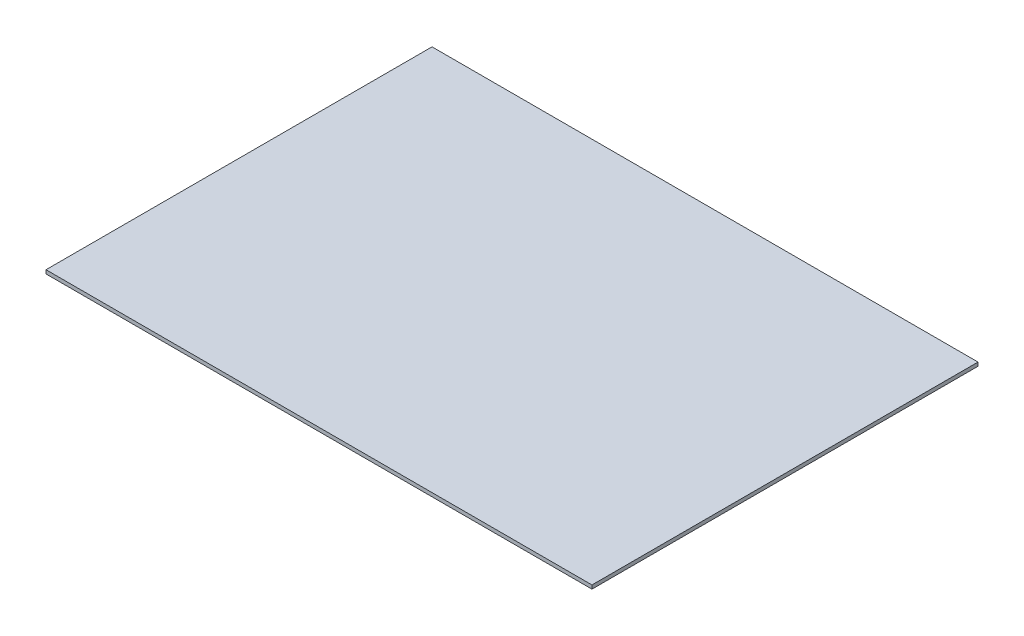
from build123d import *

# Parameters (mm, degrees)
SKETCH1_W           = 297
SKETCH1_H           = 210
BOSS_EXTRUDE1_DEPTH = 2


with BuildPart() as part:
    # Sketch1 → Boss-Extrude1 (new body)
    with BuildSketch(Plane(origin=(0, 0, 0), x_dir=(1, 0, 0), z_dir=(0, 1, 0))):
        Rectangle(SKETCH1_W, SKETCH1_H)
    extrude(amount=BOSS_EXTRUDE1_DEPTH)


solid = part.part
